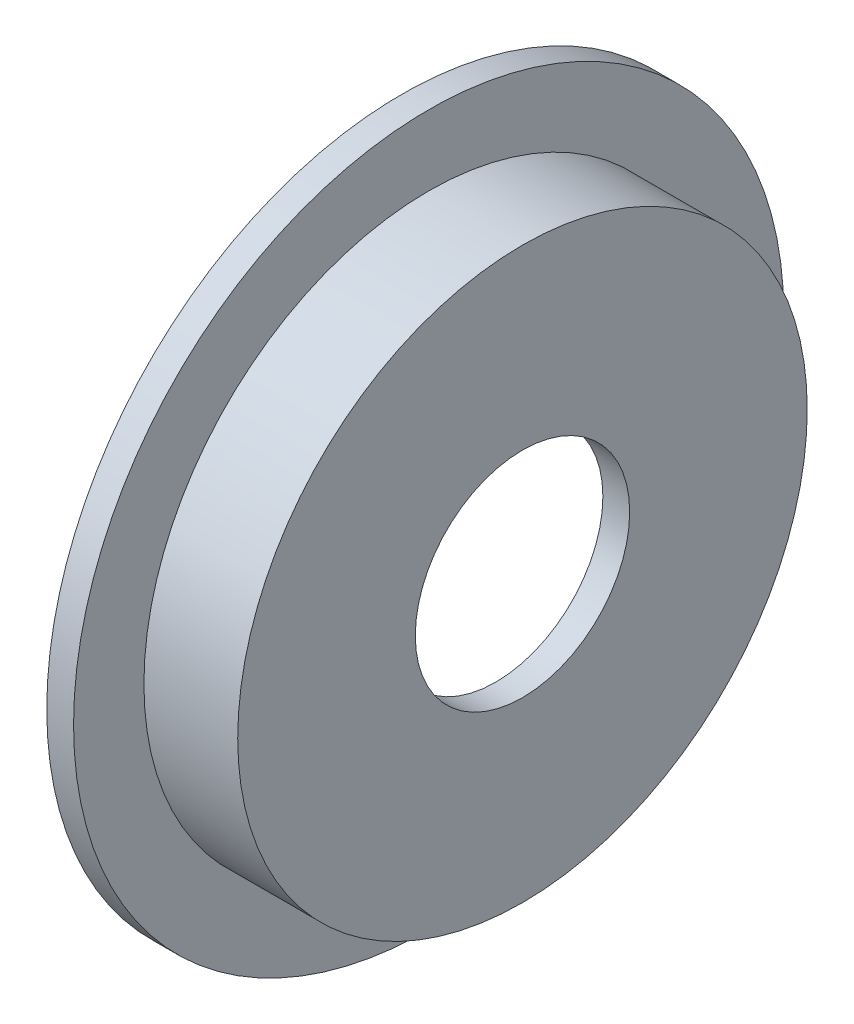
from build123d import *


with BuildPart() as part:
    # 草图1 → 旋转1 (revolve)
    with BuildSketch(Plane.XY, mode=Mode.PRIVATE) as revolve_1_sk:
        Polygon((0, 26.5), (2, 26.5), (2, 21.25), (9, 21.25), (9, 8), (7, 8), (7, 19.25), (0, 19.25), align=None)
    revolve(revolve_1_sk.sketch.rotate(Axis((-17.546362413, 0, 0), (1, 0, 0)), 90), axis=Axis((-17.546362413, 0, 0), (1, 0, 0)))


solid = part.part
